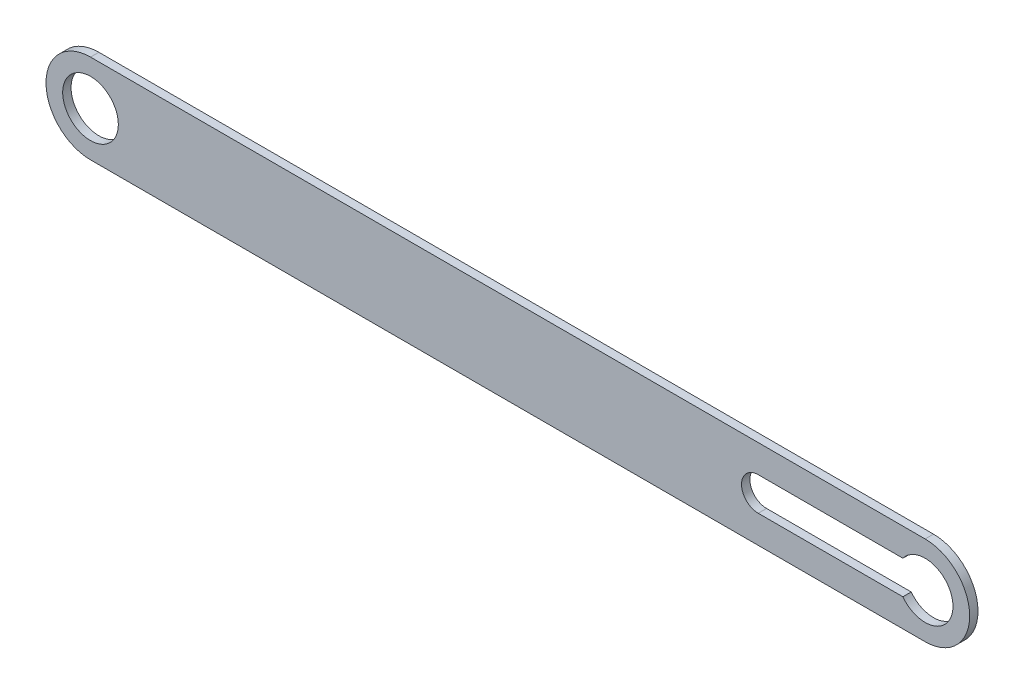
from build123d import *

# Parameters (mm, degrees)
SKETCH1_R           = 5
BOSS_EXTRUDE1_DEPTH = 1.5


with BuildPart() as part:
    # Sketch1 → Boss-Extrude1 (new body)
    with BuildSketch(Plane.XY):
        with BuildLine():
            Line((-75, 8), (75, 8))
            ThreePointArc((75, 8), (83, 0), (75, -8))
            Line((75, -8), (-75, -8))
            ThreePointArc((-75, -8), (-83, 0), (-75, 8))
        make_face()
        with Locations((-75, 0)):
            Circle(SKETCH1_R, mode=Mode.SUBTRACT)
        with BuildLine():
            Line((71, -3), (45, -3))
            ThreePointArc((45, -3), (42, 0), (45, 3))
            Line((45, 3), (71, 3))
            ThreePointArc((71, 3), (80, 0), (71, -3))
        make_face(mode=Mode.SUBTRACT)
    extrude(amount=BOSS_EXTRUDE1_DEPTH)


solid = part.part
